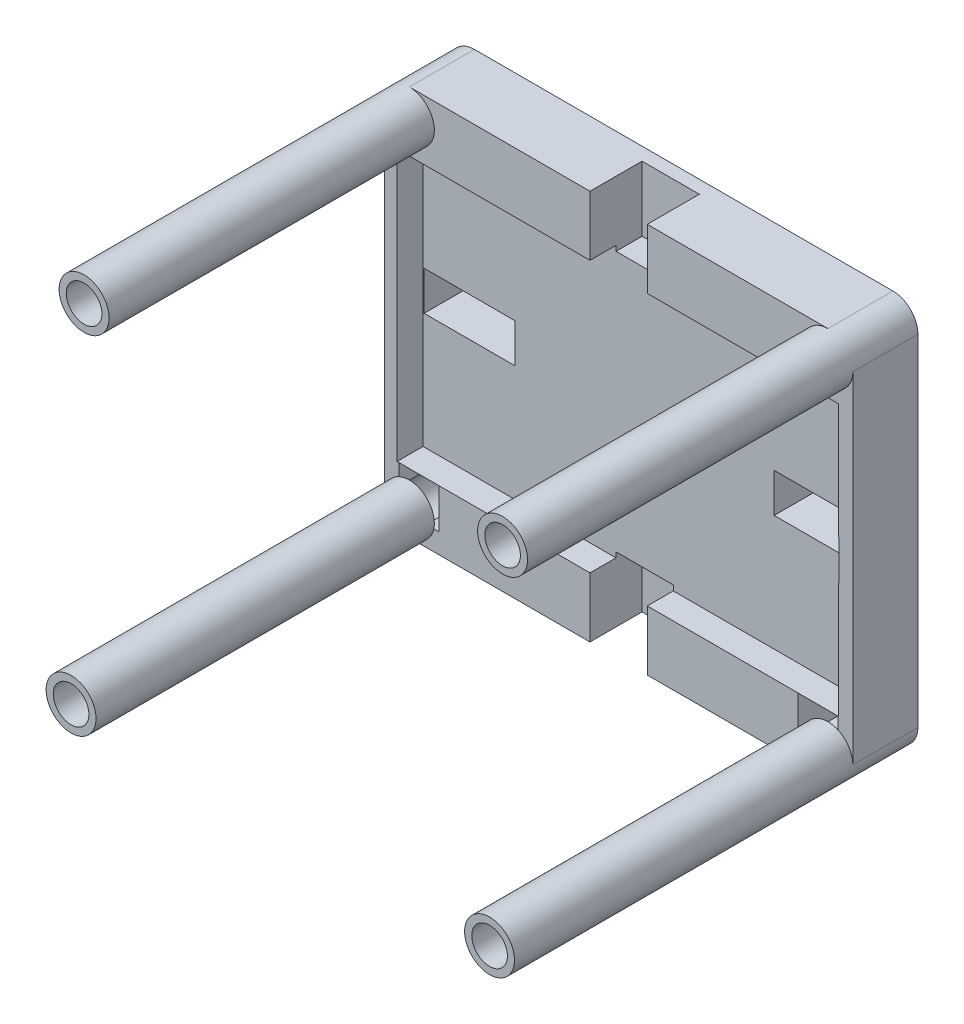
from build123d import *

# Parameters (mm, degrees)
EXTRUDE_1_DEPTH     = 25
SKETCH_1_17_R       = 9.592659
SKETCH_1_17_R_2     = 6.850965
EXTRUDE_2_DEPTH     = 150
SKETCH_1_20_W       = 35
SKETCH_1_20_H       = 15
EXTRUDE_3_DEPTH     = 15
EXTRUDE_4_DEPTH     = 25
EXTRUDE_START       = 130
SKETCH_4_R          = 9.592659
SKETCH_4_R_2        = 6.850965
EXTRUDE_6_DEPTH     = 130
SKETCH_2_R          = 6.850965
SKETCH_2_W          = 22
SKETCH_2_H          = 25
CUT_EXTRUDE_3_DEPTH = 20
SKETCH_1_24_W       = 22
SKETCH_1_24_H       = 25
EXTRUDE_7_DEPTH     = 5


with BuildPart() as part:
    # 草图1 → 凸台-拉伸1 (new body)
    with BuildSketch(Plane.XY):
        with BuildLine():
            Line((80.407341, 75), (-80.407341, 75))
            ThreePointArc((-80.407341, 75), (-73.624307, 72.190375), (-70.814682, 65.407341))
            ThreePointArc((-70.814682, 65.407341), (-80.407341, 55.814682), (-90, 65.407341))
            Line((-90, 65.407341), (-90, -65.407341))
            ThreePointArc((-90, -65.407341), (-88.477063, -60.220946), (-84.391818, -56.681343))
            Line((-84.391818, -56.681343), (-84.391818, -52.005893))
            Line((-84.391818, -52.005893), (-68.96011, -52.005893))
            Line((-68.96011, -52.005893), (-68.96011, -67.317479))
            Line((-68.96011, -67.317479), (-71.006784, -67.317479))
            ThreePointArc((-71.006784, -67.317479), (-74.337094, -72.835073), (-80.407341, -75))
            Line((-80.407341, -75), (-11, -75))
            Line((-11, -75), (-11, -52))
            Line((-11, -52), (-85.145949, -52))
            Line((-85.145949, -52), (-85.145949, 52))
            Line((-85.145949, 52), (-7.782014, 52))
            Line((-7.782014, 52), (7.782014, 52))
            Line((7.782014, 52), (84.438427, 52))
            Line((84.438427, 52), (84.438427, 7.5))
            Line((84.438427, 7.5), (84.764477, 7.5))
            Line((84.764477, 7.5), (84.764477, -7.5))
            Line((84.764477, -7.5), (84.438427, -7.5))
            Line((84.438427, -7.5), (84.438427, -52))
            Line((84.438427, -52), (84.391818, -52.005893))
            Line((84.391818, -52.005893), (84.391818, -56.681343))
            ThreePointArc((84.391818, -56.681343), (88.477063, -60.220946), (90, -65.407341))
            Line((90, -65.407341), (90, 65.407341))
            ThreePointArc((90, 65.407341), (73.624307, 58.624307), (80.407341, 75))
        make_face()
    extrude(amount=EXTRUDE_1_DEPTH)

    # 草图1<17> → 凸台-拉伸2 (add)
    # profile 1 of 4: a face of its own
    with BuildSketch(Plane.XY):
        with Locations((-80.407341, 65.407341)):
            Circle(SKETCH_1_17_R)
        with Locations((-80.407341, 65.407341)):
            Circle(SKETCH_1_17_R_2, mode=Mode.SUBTRACT)
    # profile 2 of 4: a face of its own
    with BuildSketch(Plane.XY):
        with Locations((80.407341, 65.407341)):
            Circle(SKETCH_1_17_R)
        with Locations((80.407341, 65.407341)):
            Circle(SKETCH_1_17_R_2, mode=Mode.SUBTRACT)
    # profile 3 of 4: a face of its own
    with BuildSketch(Plane.XY):
        with BuildLine():
            ThreePointArc((-84.391818, -56.681343), (-86.375199, -72.917586), (-71.006784, -67.317479))
            Line((-71.006784, -67.317479), (-73.828048, -67.317479))
            ThreePointArc((-73.828048, -67.317479), (-84.367525, -70.99775), (-84.391818, -59.834221))
            Line((-84.391818, -59.834221), (-84.391818, -56.681343))
        make_face()
    # profile 4 of 4: a face of its own
    with BuildSketch(Plane.XY):
        with BuildLine():
            ThreePointArc((71.006784, -67.317479), (86.375199, -72.917586), (84.391818, -56.681343))
            Line((84.391818, -56.681343), (84.391818, -59.834221))
            ThreePointArc((84.391818, -59.834221), (84.367525, -70.99775), (73.828048, -67.317479))
            Line((73.828048, -67.317479), (71.006784, -67.317479))
        make_face()
    extrude(amount=EXTRUDE_2_DEPTH)

    # 草图1<20> → 凸台-拉伸3 (add)
    with BuildSketch(Plane.XY):
        Polygon((-85.145949, -52), (-11, -52), (-11, -50), (11, -50), (11, -52), (84.438427, -52), (84.438427, -7.5), (49.764477, -7.5), (49.764477, 7.5), (84.438427, 7.5), (84.438427, 52), (7.782014, 52), (-7.782014, 52), (-85.145949, 52), align=None)
        with Locations((-67.264477, 0)):
            Rectangle(SKETCH_1_20_W, SKETCH_1_20_H, mode=Mode.SUBTRACT)
    extrude(amount=EXTRUDE_3_DEPTH)

    # 草图1<21> → 凸台-拉伸4 (add)
    with BuildSketch(Plane.XY):
        with BuildLine():
            Line((11, -75), (80.407341, -75))
            ThreePointArc((80.407341, -75), (74.337094, -72.835073), (71.006784, -67.317479))
            Line((71.006784, -67.317479), (68.96011, -67.317479))
            Line((68.96011, -67.317479), (68.96011, -52.005893))
            Line((68.96011, -52.005893), (84.391818, -52.005893))
            Line((84.391818, -52.005893), (84.438427, -52))
            Line((84.438427, -52), (11, -52))
            Line((11, -52), (11, -75))
        make_face()
    extrude(amount=EXTRUDE_4_DEPTH)

    # 草图4 → 凸台-拉伸6 (add)
    # profile 1 of 2: a face of its own
    with BuildSketch(Plane(origin=(0, 0, 155), x_dir=(-1, 0, 0), z_dir=(0, 0, -1)).offset(EXTRUDE_START)):
        with Locations((80.407341, -65.407341)):
            Circle(SKETCH_4_R)
        with Locations((80.407341, -65.407341)):
            Circle(SKETCH_4_R_2, mode=Mode.SUBTRACT)
    # profile 2 of 2: a face of its own
    with BuildSketch(Plane(origin=(0, 0, 155), x_dir=(-1, 0, 0), z_dir=(0, 0, -1)).offset(EXTRUDE_START)):
        with Locations((-80.407341, -65.407341)):
            Circle(SKETCH_4_R)
        with Locations((-80.407341, -65.407341)):
            Circle(SKETCH_4_R_2, mode=Mode.SUBTRACT)
    extrude(amount=-EXTRUDE_6_DEPTH)

    # 草图2 → 切除-拉伸3 (cut, symmetric)
    with BuildSketch(Plane(origin=(0, 0, 25), x_dir=(-1, 0, 0), z_dir=(0, 0, -1))):
        with Locations((-80.407341, -65.407341)):
            Circle(SKETCH_2_R)
        with Locations((80.407341, -65.407341)):
            Circle(SKETCH_2_R)
        with Locations((0, -62.5)):
            Rectangle(SKETCH_2_W, SKETCH_2_H)
        with Locations((0, 62.5)):
            Rectangle(SKETCH_2_W, SKETCH_2_H)
    extrude(amount=CUT_EXTRUDE_3_DEPTH, both=True, mode=Mode.SUBTRACT)

    # 草图1<24> → 凸台-拉伸7 (add)
    with BuildSketch(Plane.XY):
        with Locations((0, -62.5)):
            Rectangle(SKETCH_1_24_W, SKETCH_1_24_H)
    extrude(amount=EXTRUDE_7_DEPTH)


solid = part.part
